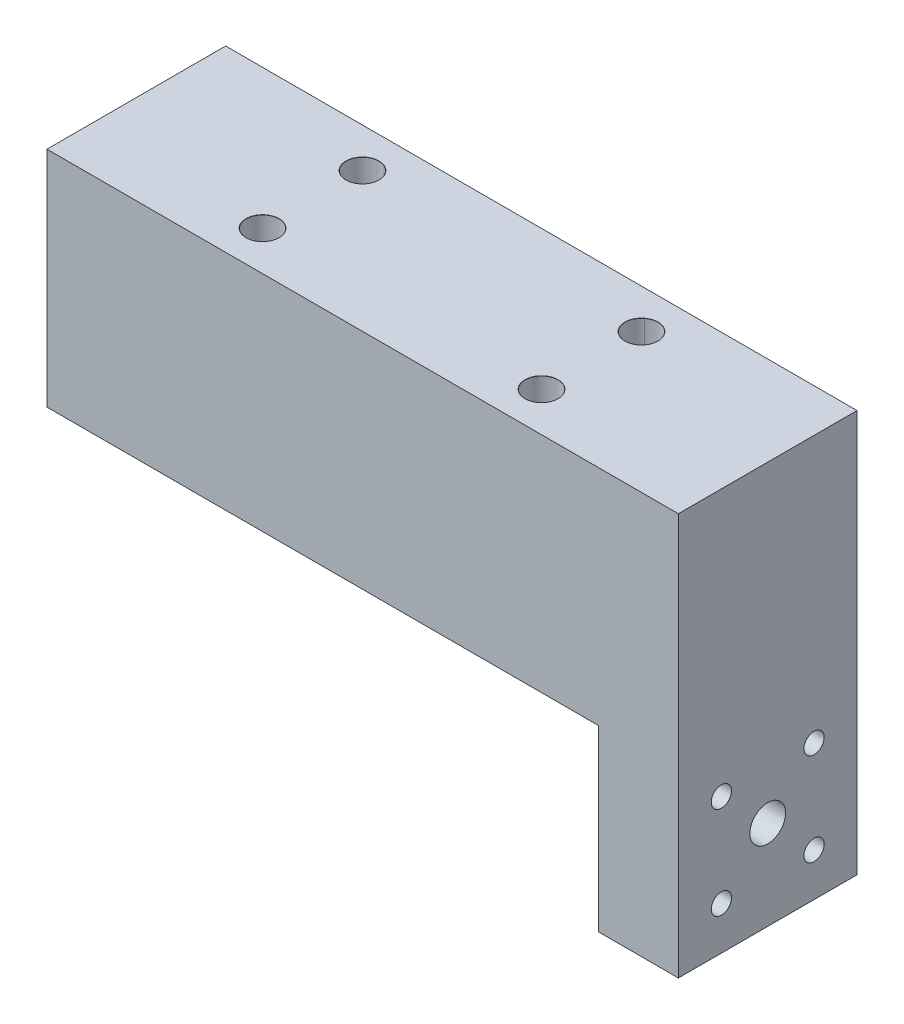
from build123d import *

# Parameters (mm, degrees)
SKETCH1_W                      = 106
SKETCH1_H                      = 67.5
BOSS_EXTRUDE1_DEPTH            = 30
SKETCH2_W                      = 92.6
SKETCH2_H                      = 30
BOSS_EXTRUDE2_DEPTH            = 30
SKETCH3_W                      = 92.6
SKETCH3_H                      = 30
CUT_EXTRUDE1_DEPTH             = 30
SKETCH4_R                      = 3
CUT_EXTRUDE2_DEPTH             = 30
M3_CLEARANCE_HOLE1_D           = 3.4
M3_CLEARANCE_HOLE1_CSINK_D     = 3.45
M3_CLEARANCE_HOLE1_CSINK_ANGLE = 90
SKETCH11_R                     = 9
CUT_EXTRUDE3_DEPTH             = 2
M5_CLEARANCE_HOLE1_AT_2_COUNT  = 2
M5_CLEARANCE_HOLE1_AT_2_PITCH  = 49.748811611
M5_CLEARANCE_HOLE1_AT_3_COUNT  = 2
M5_CLEARANCE_HOLE1_AT_3_PITCH  = 46.836464196
M5_CLEARANCE_HOLE1_AT_4_COUNT  = 2
M5_CLEARANCE_HOLE1_AT_4_PITCH  = 16.77169873
M5_CLEARANCE_HOLE1_AT_5_COUNT  = 2
M5_CLEARANCE_HOLE1_AT_5_PITCH  = 16.771686167
M5_CLEARANCE_HOLE1_AT_6_COUNT  = 2
M5_CLEARANCE_HOLE1_AT_6_PITCH  = 49.748806755
M5_CLEARANCE_HOLE1_AT_7_COUNT  = 2
M5_CLEARANCE_HOLE1_AT_7_PITCH  = 49.748790588
M5_CLEARANCE_HOLE1_AT_8_COUNT  = 2
M5_CLEARANCE_HOLE1_AT_8_PITCH  = 46.836452861


with BuildPart() as part:
    # Sketch1 → Boss-Extrude1 (new body)
    with BuildSketch(Plane.XY):
        with Locations((-7.205998582, -5.840323621)):
            Rectangle(SKETCH1_W, SKETCH1_H)
    extrude(amount=BOSS_EXTRUDE1_DEPTH)

    # Sketch2 → Boss-Extrude2 (add)
    with BuildSketch(Plane.XY):
        with Locations((-13.905998582, -24.590323621)):
            Rectangle(SKETCH2_W, SKETCH2_H)
    extrude(amount=BOSS_EXTRUDE2_DEPTH)

    # Sketch3 → Cut-Extrude1 (cut)
    with BuildSketch(Plane.XY):
        with Locations((-13.905998582, -24.590323621)):
            Rectangle(SKETCH3_W, SKETCH3_H)
    extrude(amount=CUT_EXTRUDE1_DEPTH, mode=Mode.SUBTRACT)

    # Sketch4 → Cut-Extrude2 (cut)
    with BuildSketch(Plane(origin=(45.794001418, 0, 0), x_dir=(0, 0, -1), z_dir=(1, 0, 0))):
        with Locations(Location((-15, -24.590323621, 0), (0, 0, 90))):
            Circle(SKETCH4_R)
    extrude(amount=-CUT_EXTRUDE2_DEPTH, mode=Mode.SUBTRACT)

    # M3 Clearance Hole1 (through all)
    with Locations(Plane.ZY.offset(-32.394001418)):
        with Locations((7.221825407, -32.368498214), (7.221825407, -16.812149028), (22.778174593, -16.812149028), (22.778174593, -32.368498214)):
            CounterSinkHole(M3_CLEARANCE_HOLE1_D / 2, M3_CLEARANCE_HOLE1_CSINK_D / 2, counter_sink_angle=M3_CLEARANCE_HOLE1_CSINK_ANGLE)

    # Sketch11 → Cut-Extrude3 (cut)
    with BuildSketch(Plane.ZY.offset(-32.394001418)):
        with Locations((15, -24.590323621)):
            Circle(SKETCH11_R)
    extrude(amount=-CUT_EXTRUDE3_DEPTH, mode=Mode.SUBTRACT)

    # Sketch12 → M5 Clearance Hole1 (revolve, cut)
    with BuildSketch(Plane(origin=(-30.624223061, 27.909676379, 23.385849743), x_dir=(0, 0, 1), z_dir=(1, 0, 0))):
        Polygon((0, 0), (0, 67.5), (2.75, 67.5), (2.75, 0.025), (2.775, 0), align=None)
    m5_clearance_hole1 = revolve(axis=Axis((-30.624223061, 34.259676379, 23.385849743), (0, -1, 0)), mode=Mode.SUBTRACT)

    # M5 Clearance Hole1 at 2: M5 Clearance Hole1 ×2
    with Locations(*[Vector(0.9414589550934056, 0, -0.3371276254987612) * (i * M5_CLEARANCE_HOLE1_AT_2_PITCH) for i in range(1, M5_CLEARANCE_HOLE1_AT_2_COUNT)]):
        add(m5_clearance_hole1, mode=Mode.SUBTRACT)

    # M5 Clearance Hole1 at 3: M5 Clearance Hole1 ×2
    with Locations(*[(i * M5_CLEARANCE_HOLE1_AT_3_PITCH, 0, 0) for i in range(1, M5_CLEARANCE_HOLE1_AT_3_COUNT)]):
        add(m5_clearance_hole1, mode=Mode.SUBTRACT)

    # M5 Clearance Hole1 at 4: M5 Clearance Hole1 ×2
    with Locations(*[(0, 0, -i * M5_CLEARANCE_HOLE1_AT_4_PITCH) for i in range(1, M5_CLEARANCE_HOLE1_AT_4_COUNT)]):
        add(m5_clearance_hole1, mode=Mode.SUBTRACT)

    # M5 Clearance Hole1 at 5: M5 Clearance Hole1 ×2
    with Locations(*[(0, 0, -i * M5_CLEARANCE_HOLE1_AT_5_PITCH) for i in range(1, M5_CLEARANCE_HOLE1_AT_5_COUNT)]):
        add(m5_clearance_hole1, mode=Mode.SUBTRACT)

    # M5 Clearance Hole1 at 6: M5 Clearance Hole1 ×2
    with Locations(*[Vector(0.9414589495083403, 0, -0.33712764109555354) * (i * M5_CLEARANCE_HOLE1_AT_6_PITCH) for i in range(1, M5_CLEARANCE_HOLE1_AT_6_COUNT)]):
        add(m5_clearance_hole1, mode=Mode.SUBTRACT)

    # M5 Clearance Hole1 at 7: M5 Clearance Hole1 ×2
    with Locations(*[Vector(0.9414589838280241, 0, -0.3371275452547662) * (i * M5_CLEARANCE_HOLE1_AT_7_PITCH) for i in range(1, M5_CLEARANCE_HOLE1_AT_7_COUNT)]):
        add(m5_clearance_hole1, mode=Mode.SUBTRACT)

    # M5 Clearance Hole1 at 8: M5 Clearance Hole1 ×2
    with Locations(*[(i * M5_CLEARANCE_HOLE1_AT_8_PITCH, 0, 0) for i in range(1, M5_CLEARANCE_HOLE1_AT_8_COUNT)]):
        add(m5_clearance_hole1, mode=Mode.SUBTRACT)


solid = part.part
